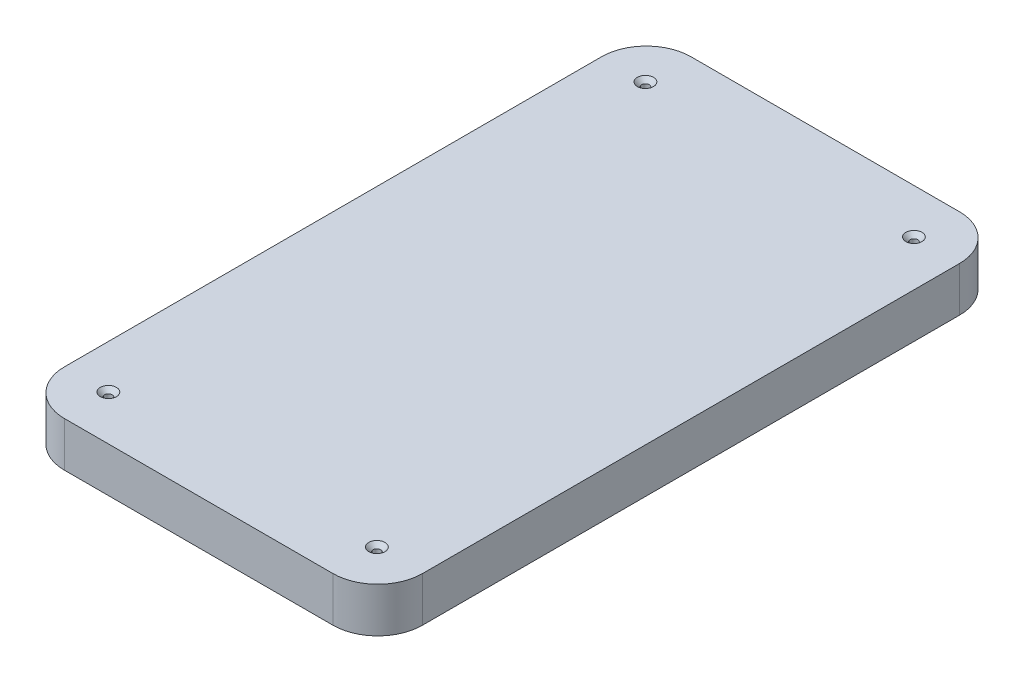
from build123d import *

# Parameters (mm, degrees)
SKETCH2_W                                            = 80
SKETCH2_H                                            = 140
BOSS_EXTRUDE1_DEPTH                                  = 10
SHELL2_T                                             = -5
BOSS_EXTRUDE4_REACH                                  = 83.24
FILLET3_R                                            = 10
CSK_FOR_M1_6_CROSS_RECESS_FLAT_HEAD_SCRE_D           = 1.7
CSK_FOR_M1_6_CROSS_RECESS_FLAT_HEAD_SCRE_CSINK_D     = 3.6
CSK_FOR_M1_6_CROSS_RECESS_FLAT_HEAD_SCRE_CSINK_ANGLE = 90


with BuildPart() as part:
    # Sketch2 → Boss-Extrude1 (new body)
    with BuildSketch(Plane(origin=(0, 0, 0), x_dir=(1, 0, 0), z_dir=(0, 1, 0))):
        Rectangle(SKETCH2_W, SKETCH2_H)
    extrude(amount=BOSS_EXTRUDE1_DEPTH)

    # Shell2
    shell2_openings = [part.faces().sort_by_distance(p)[0] for p in [
        (0, 0, 0),
    ]]
    offset(amount=SHELL2_T, openings=shell2_openings, kind=Kind.INTERSECTION)

    # Sketch6 → Boss-Extrude4 (add, up to next)
    with BuildSketch(Plane.XZ, mode=Mode.PRIVATE) as boss_extrude4_sk1:
        with BuildLine():
            Line((-30, 55), (-35, 55))
            Line((-35, 55), (-35, 65))
            Line((-35, 65), (-25, 65))
            Line((-25, 65), (-25, 60))
            ThreePointArc((-25, 60), (-26.464466094, 56.464466094), (-30, 55))
        make_face()
    boss_extrude4_tool1 = extrude(boss_extrude4_sk1.sketch, amount=-BOSS_EXTRUDE4_REACH, mode=Mode.PRIVATE) - part.part
    # Sketch6 → Boss-Extrude4 (add, up to next)
    with BuildSketch(Plane.XZ, mode=Mode.PRIVATE) as boss_extrude4_sk2:
        with BuildLine():
            Line((25, 60), (25, 65))
            Line((25, 65), (35, 65))
            Line((35, 65), (35, 55))
            Line((35, 55), (30, 55))
            ThreePointArc((30, 55), (26.464466094, 56.464466094), (25, 60))
        make_face()
    boss_extrude4_tool2 = extrude(boss_extrude4_sk2.sketch, amount=-BOSS_EXTRUDE4_REACH, mode=Mode.PRIVATE) - part.part
    # Sketch6 → Boss-Extrude4 (add, up to next)
    with BuildSketch(Plane.XZ, mode=Mode.PRIVATE) as boss_extrude4_sk3:
        with BuildLine():
            Line((30, -55), (35, -55))
            Line((35, -55), (35, -65))
            Line((35, -65), (25, -65))
            Line((25, -65), (25, -60))
            ThreePointArc((25, -60), (26.464466094, -56.464466094), (30, -55))
        make_face()
    boss_extrude4_tool3 = extrude(boss_extrude4_sk3.sketch, amount=-BOSS_EXTRUDE4_REACH, mode=Mode.PRIVATE) - part.part
    # Sketch6 → Boss-Extrude4 (add, up to next)
    with BuildSketch(Plane.XZ, mode=Mode.PRIVATE) as boss_extrude4_sk4:
        with BuildLine():
            Line((-25, -60), (-25, -65))
            Line((-25, -65), (-35, -65))
            Line((-35, -65), (-35, -55))
            Line((-35, -55), (-30, -55))
            ThreePointArc((-30, -55), (-26.464466094, -56.464466094), (-25, -60))
        make_face()
    boss_extrude4_tool4 = extrude(boss_extrude4_sk4.sketch, amount=-BOSS_EXTRUDE4_REACH, mode=Mode.PRIVATE) - part.part
    add(boss_extrude4_tool1.solids().sort_by_distance((-30.220144, 0, 60.220144))[0])
    add(boss_extrude4_tool2.solids().sort_by_distance((30.220144, 0, 60.220144))[0])
    add(boss_extrude4_tool3.solids().sort_by_distance((30.220144, 0, -60.220144))[0])
    add(boss_extrude4_tool4.solids().sort_by_distance((-30.220144, 0, -60.220144))[0])

    # Fillet3
    fillet3_edges = [part.edges().sort_by_distance(p)[0] for p in [
        (40, 5, 70),
        (-40, 5, 70),
        (-40, 5, -70),
        (40, 5, -70),
    ]]
    fillet(fillet3_edges, radius=FILLET3_R)

    # CSK for M1.6 Cross Recess Flat Head Screw1 (through all)
    with Locations(Plane(origin=(0, 10, 0), x_dir=(1, 0, 0), z_dir=(0, 1, 0))):
        with Locations((-30.216332876, 60.028429813), (29.772350977, 60.028429813), (29.772350977, -59.957909435), (-30.216332876, -59.957909435)):
            CounterSinkHole(CSK_FOR_M1_6_CROSS_RECESS_FLAT_HEAD_SCRE_D / 2, CSK_FOR_M1_6_CROSS_RECESS_FLAT_HEAD_SCRE_CSINK_D / 2, counter_sink_angle=CSK_FOR_M1_6_CROSS_RECESS_FLAT_HEAD_SCRE_CSINK_ANGLE)


solid = part.part
